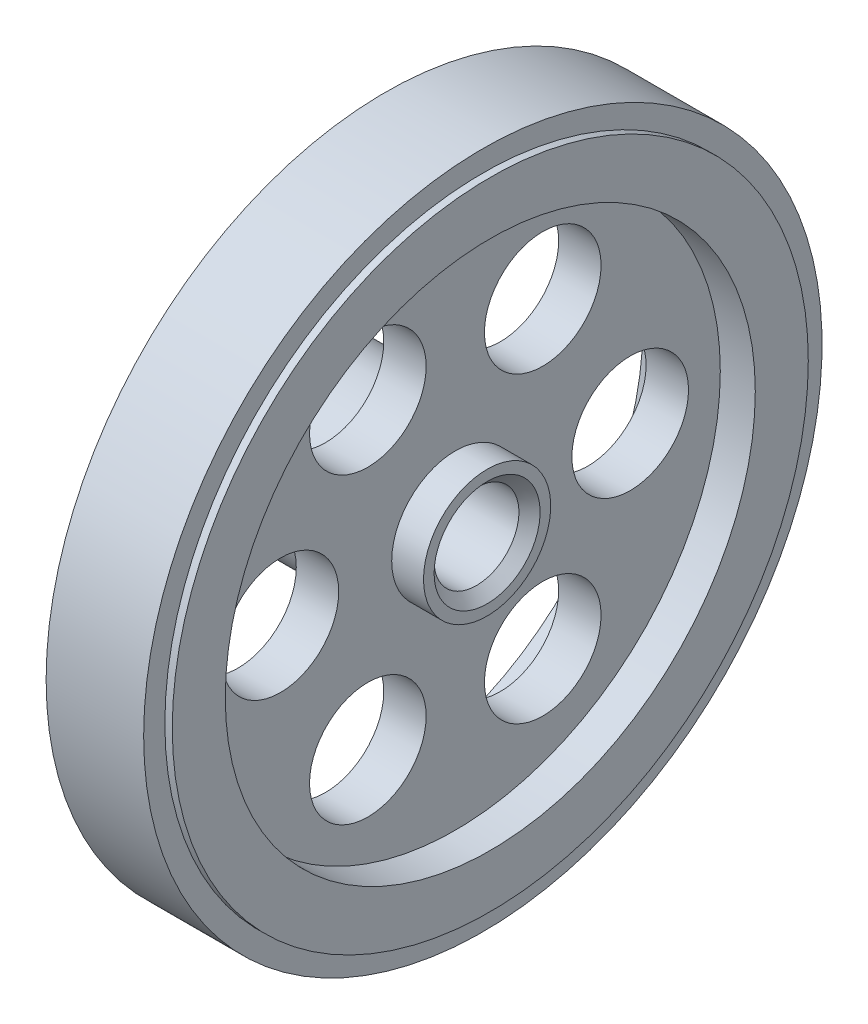
from build123d import *

# Parameters (mm, degrees)
CHAMFER1_SIZE           = 1
CUT_EXTRUDE1_DEPTH      = 48.370877129
CUT_EXTRUDE1_DEPTH_BACK = 48.370877129
SKETCH2_R               = 5.5


with BuildPart() as part:
    # Sketch1 → Revolve1 (revolve)
    with BuildSketch(Plane(origin=(0, 0, 0), x_dir=(1, 0, 0), z_dir=(0, 1, 0)), mode=Mode.PRIVATE) as revolve1_sk:
        Polygon((17, 4), (0, 4), (0, 8), (10, 8), (10, 25), (6.7, 25), (6.7, 30), (7.4, 30), (7.4, 32), (16.6, 32), (16.6, 30), (17.3, 30), (17.3, 25), (14, 25), (14, 6), (17, 6), align=None)
    revolve(revolve1_sk.sketch.rotate(Axis((0, 0, 0), (1, 0, 0)), 180), axis=Axis((0, 0, 0), (1, 0, 0)))

    # Chamfer1
    chamfer1_edges = [part.edges().sort_by_distance(p)[0] for p in [
        (0, 0, -4),
        (17, 0, -4),
    ]]
    chamfer(chamfer1_edges, length=CHAMFER1_SIZE)

    # Sketch2 → Cut-Extrude1 (cut, two sides: drawn at the far end of the back side and taken through both)
    with BuildSketch(Plane(origin=(14, 0, 0), x_dir=(0, 0, -1), z_dir=(1, 0, 0)).offset(-CUT_EXTRUDE1_DEPTH_BACK)):
        with Locations((-16.5, 0)):
            Circle(SKETCH2_R)
        with Locations((-8.25, 14.289419162)):
            Circle(SKETCH2_R)
        with Locations((8.25, 14.289419162)):
            Circle(SKETCH2_R)
        with Locations((16.5, 0)):
            Circle(SKETCH2_R)
        with Locations((8.25, -14.289419162)):
            Circle(SKETCH2_R)
        with Locations((-8.25, -14.289419162)):
            Circle(SKETCH2_R)
    extrude(amount=CUT_EXTRUDE1_DEPTH + CUT_EXTRUDE1_DEPTH_BACK, mode=Mode.SUBTRACT)


solid = part.part
